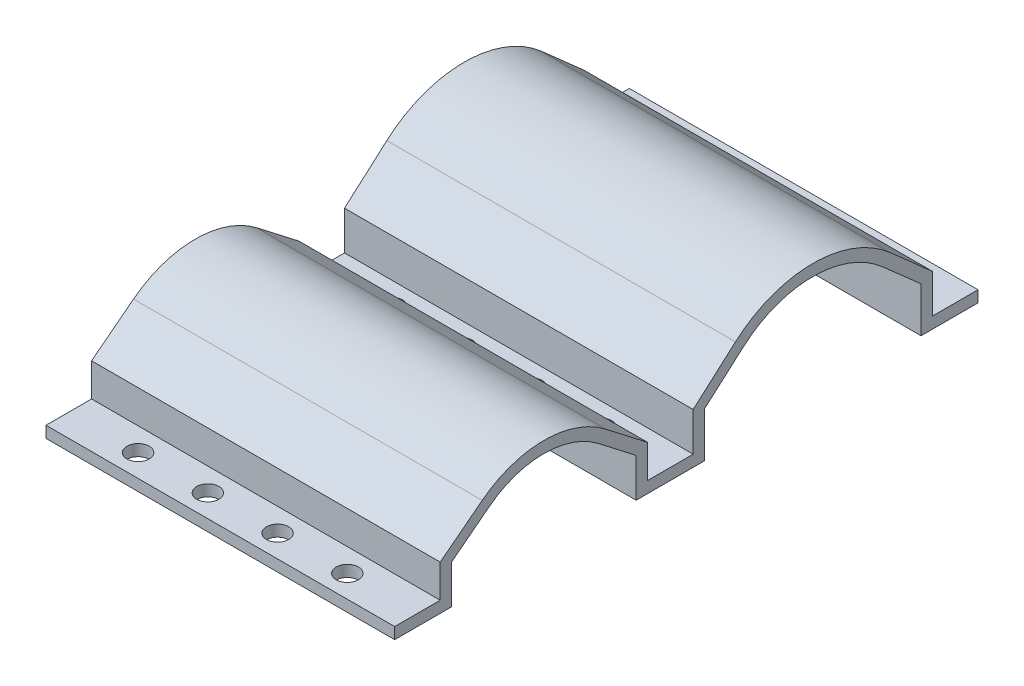
from build123d import *

# Parameters (mm, degrees)
BOSS_EXTRUDE1_DEPTH = 61.2
SKETCH3_R           = 1.95
CUT_EXTRUDE1_DEPTH  = 2


with BuildPart() as part:
    # Sketch2 → Boss-Extrude1 (new body)
    with BuildSketch(Plane(origin=(0, 0, 0), x_dir=(0, 0, -1), z_dir=(1, 0, 0))):
        with BuildLine():
            Line((0, 0), (-10, 0))
            Line((-10, 0), (-10, 7.898424126))
            Line((-10, 7.898424126), (-16.749767181, 13.862964902))
            ThreePointArc((-16.749767181, 13.862964902), (-29, 18.5), (-41.250232819, 13.862964902))
            Line((-41.250232819, 13.862964902), (-48, 7.898424126))
            Line((-48, 7.898424126), (-48, 0))
            Line((-48, 0), (-60, 0))
            Line((-60, 0), (-60, 6.817623549))
            Line((-60, 6.817623549), (-66.59398274, 11.918310368))
            ThreePointArc((-66.59398274, 11.918310368), (-76.2, 15.2), (-85.80601726, 11.918310368))
            Line((-85.80601726, 11.918310368), (-92.4, 6.817623549))
            Line((-92.4, 6.817623549), (-92.4, 0))
            Line((-92.4, 0), (-102.4, 0))
            Line((-102.4, 0), (-102.4, 2))
            Line((-102.4, 2), (-94.4, 2))
            Line((-94.4, 2), (-94.4, 7.799074738))
            Line((-94.4, 7.799074738), (-87.029713726, 13.500260734))
            ThreePointArc((-87.029713726, 13.500260734), (-76.2, 17.2), (-65.370286274, 13.500260734))
            Line((-65.370286274, 13.500260734), (-58, 7.799074738))
            Line((-58, 7.799074738), (-58, 2))
            Line((-58, 2), (-50, 2))
            Line((-50, 2), (-50, 8.800073553))
            Line((-50, 8.800073553), (-42.574582313, 15.361663811))
            ThreePointArc((-42.574582313, 15.361663811), (-29, 20.5), (-15.425417687, 15.361663811))
            Line((-15.425417687, 15.361663811), (-8, 8.800073553))
            Line((-8, 8.800073553), (-8, 2))
            Line((-8, 2), (0, 2))
            Line((0, 2), (0, 0))
        make_face()
    extrude(amount=BOSS_EXTRUDE1_DEPTH)

    # Sketch3 → Cut-Extrude1 (cut)
    with BuildSketch(Plane(origin=(0, 2, 0), x_dir=(1, 0, 0), z_dir=(0, 1, 0))):
        with Locations(Location((12.24, -3.93, 0), (0, 0, 270))):
            Circle(SKETCH3_R)
        with Locations(Location((24.48, -3.93, 0), (0, 0, 270))):
            Circle(SKETCH3_R)
        with Locations(Location((36.72, -3.93, 0), (0, 0, 270))):
            Circle(SKETCH3_R)
        with Locations(Location((48.96, -3.93, 0), (0, 0, 270))):
            Circle(SKETCH3_R)
        with Locations(Location((12.24, -53.992271577, 0), (0, 0, 270))):
            Circle(SKETCH3_R)
        with Locations(Location((24.48, -53.992271577, 0), (0, 0, 270))):
            Circle(SKETCH3_R)
        with Locations(Location((36.72, -53.992271577, 0), (0, 0, 270))):
            Circle(SKETCH3_R)
        with Locations(Location((48.96, -53.992271577, 0), (0, 0, 270))):
            Circle(SKETCH3_R)
        with Locations(Location((12.24, -98.47, 0), (0, 0, 270))):
            Circle(SKETCH3_R)
        with Locations(Location((24.48, -98.47, 0), (0, 0, 270))):
            Circle(SKETCH3_R)
        with Locations(Location((36.72, -98.47, 0), (0, 0, 270))):
            Circle(SKETCH3_R)
        with Locations(Location((48.96, -98.47, 0), (0, 0, 270))):
            Circle(SKETCH3_R)
    extrude(amount=-CUT_EXTRUDE1_DEPTH, mode=Mode.SUBTRACT)


solid = part.part
